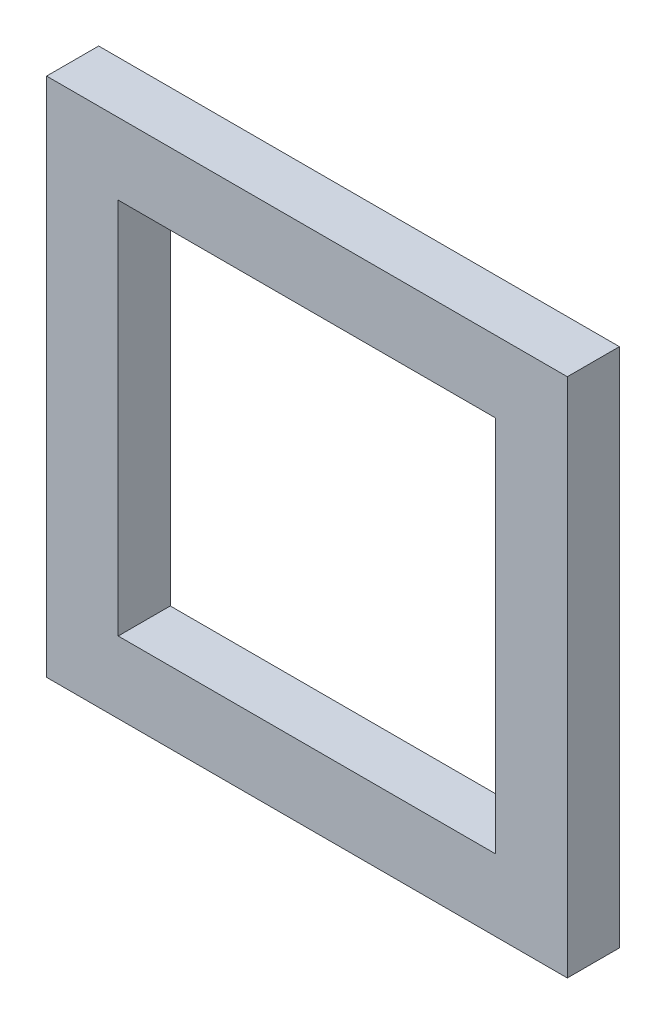
from build123d import *

# Parameters (mm, degrees)
SKETCH1_W           = 127
SKETCH1_H           = 127
SKETCH1_W_2         = 92.075
SKETCH1_H_2         = 92.075
BOSS_EXTRUDE1_DEPTH = 12.7


with BuildPart() as part:
    # Sketch1 → Boss-Extrude1 (new body)
    with BuildSketch(Plane.XY):
        Rectangle(SKETCH1_W, SKETCH1_H)
        Rectangle(SKETCH1_W_2, SKETCH1_H_2, mode=Mode.SUBTRACT)
    extrude(amount=-BOSS_EXTRUDE1_DEPTH)


solid = part.part
